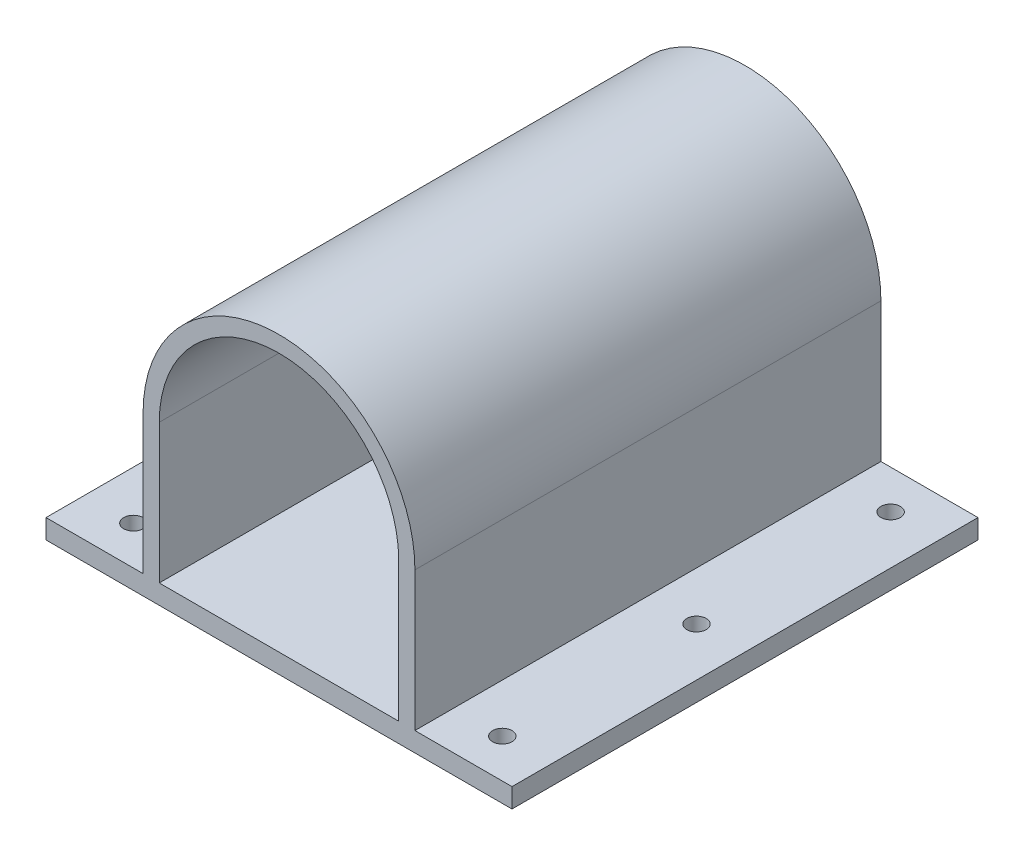
from build123d import *

# Parameters (mm, degrees)
SKETCH1_R           = 1.65
SKETCH1_R_2         = 6.15
BOSS_EXTRUDE1_DEPTH = 72
CUT_EXTRUDE1_DEPTH  = 57
SKETCH3_R           = 1.5
CUT_EXTRUDE2_DEPTH  = 92.028841583
FILLET1_R           = 6


with BuildPart() as part:
    # Sketch1 → Boss-Extrude1 (new body)
    with BuildSketch(Plane.XY):
        with BuildLine():
            Line((-21, 0), (-21, -21.5))
            Line((-21, -21.5), (-36, -21.5))
            Line((-36, -21.5), (-36, -24.5))
            Line((-36, -24.5), (36, -24.5))
            Line((36, -24.5), (36, -21.5))
            Line((36, -21.5), (21, -21.5))
            Line((21, -21.5), (21, 0))
            ThreePointArc((21, 0), (0, 21), (-21, 0))
        make_face()
        with Locations((0, -15.5)):
            Circle(SKETCH1_R, mode=Mode.SUBTRACT)
        with Locations((-13.423393759, -7.75)):
            Circle(SKETCH1_R, mode=Mode.SUBTRACT)
        with Locations((-13.423393759, 7.75)):
            Circle(SKETCH1_R, mode=Mode.SUBTRACT)
        with Locations((0, 15.5)):
            Circle(SKETCH1_R, mode=Mode.SUBTRACT)
        with Locations((13.423393759, 7.75)):
            Circle(SKETCH1_R, mode=Mode.SUBTRACT)
        with Locations((13.423393759, -7.75)):
            Circle(SKETCH1_R, mode=Mode.SUBTRACT)
        with Locations((-7, 0)):
            Circle(SKETCH1_R_2, mode=Mode.SUBTRACT)
    extrude(amount=BOSS_EXTRUDE1_DEPTH)

    # Sketch2 → Cut-Extrude1 (cut)
    with BuildSketch(Plane.XY.offset(72)):
        with BuildLine():
            Line((-18.5, 0), (-18.5, -21.5))
            Line((-18.5, -21.5), (18.5, -21.5))
            Line((18.5, -21.5), (18.5, 0))
            ThreePointArc((18.5, 0), (0, 18.5), (-18.5, 0))
        make_face()
    extrude(amount=-CUT_EXTRUDE1_DEPTH, mode=Mode.SUBTRACT)

    # Sketch3 → Cut-Extrude2 (cut, through all)
    with BuildSketch(Plane(origin=(0, -21.5, 0), x_dir=(1, 0, 0), z_dir=(0, 1, 0))):
        with Locations(Location((-28.5, -36, 0), (0, 0, 270))):
            Circle(SKETCH3_R)
        with Locations(Location((-28.5, -6, 0), (0, 0, 270))):
            Circle(SKETCH3_R)
        with Locations(Location((-28.5, -66, 0), (0, 0, 270))):
            Circle(SKETCH3_R)
        with Locations(Location((28.5, -66, 0), (0, 0, 90))):
            Circle(SKETCH3_R)
        with Locations(Location((28.5, -6, 0), (0, 0, 90))):
            Circle(SKETCH3_R)
        with Locations(Location((28.5, -36, 0), (0, 0, 90))):
            Circle(SKETCH3_R)
    extrude(amount=-CUT_EXTRUDE2_DEPTH, mode=Mode.SUBTRACT)

    # Fillet1
    fillet1_edges = [part.edges().sort_by_distance(p)[0] for p in [
        (-36, -23, 0),
    ]]
    fillet(fillet1_edges, radius=FILLET1_R)


solid = part.part
